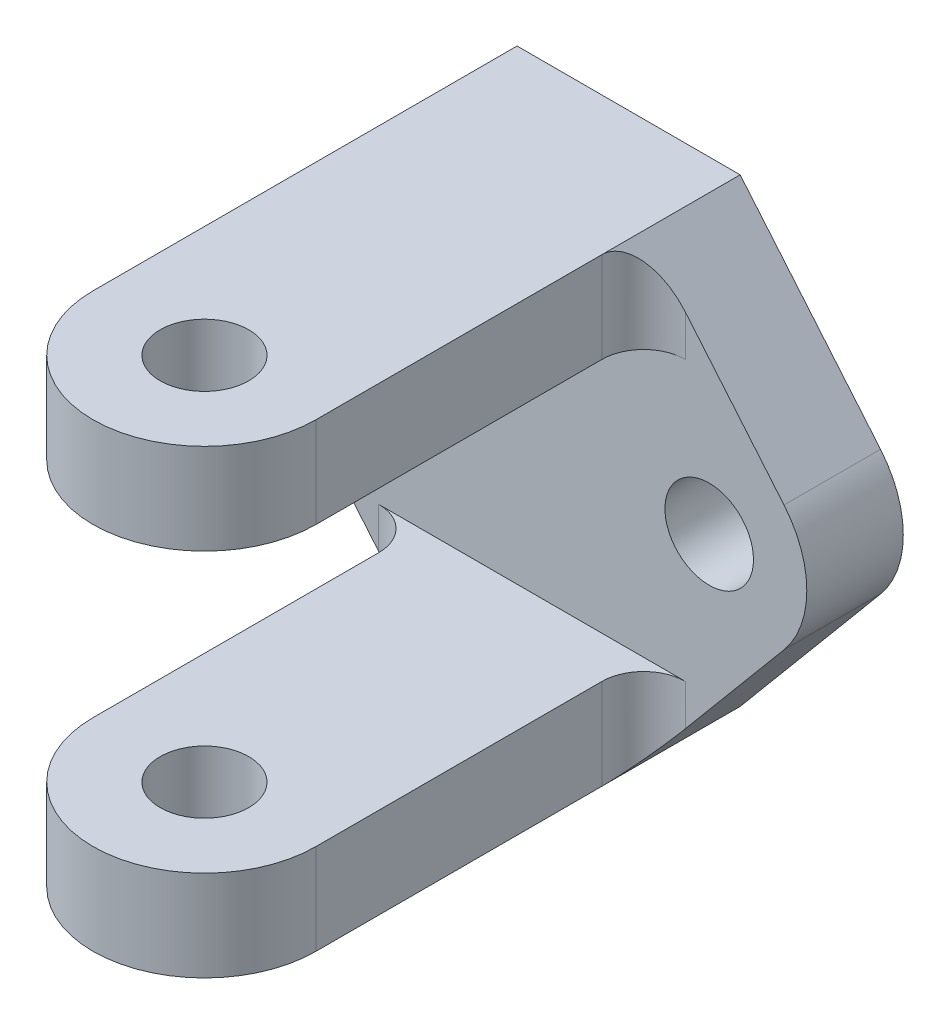
from build123d import *

# Parameters (mm, degrees)
SKETCH1_W                      = 41.4
SKETCH1_H                      = 33.02
SKETCH1_R                      = 3.175
BOSS_EXTRUDE1_DEPTH            = 12
SKETCH2_W                      = 41.4
SKETCH2_H                      = 6.51
BOSS_EXTRUDE2_DEPTH            = 53
CUT_EXTRUDE1_REACH             = 72.186
SKETCH4_R                      = 3.175
CUT_EXTRUDE1_DIRECTION_2_REACH = 72.186
CUT_EXTRUDE3_REACH             = 72.186
CUT_EXTRUDE3_DIRECTION_2_REACH = 72.186
CUT_EXTRUDE4_DEPTH             = 12
BOSS_EXTRUDE3_DEPTH            = 12
FILLET3_R                      = 3
CUT_EXTRUDE5_DEPTH             = 5.08


with BuildPart() as part:
    # Sketch1 → Boss-Extrude1 (new body)
    with BuildSketch(Plane.XY):
        Rectangle(SKETCH1_W, SKETCH1_H)
        with Locations((12.7, 0)):
            Circle(SKETCH1_R, mode=Mode.SUBTRACT)
        with Locations((-12.7, 0)):
            Circle(SKETCH1_R, mode=Mode.SUBTRACT)
    extrude(amount=BOSS_EXTRUDE1_DEPTH)

    # Sketch2 → Boss-Extrude2 (add)
    with BuildSketch(Plane.XY.offset(12)):
        with Locations((0, 13.255)):
            Rectangle(SKETCH2_W, SKETCH2_H)
        with Locations((0, -13.255)):
            Rectangle(SKETCH2_W, SKETCH2_H)
    extrude(amount=BOSS_EXTRUDE2_DEPTH)

    # Cut-Extrude1: up to this face of the body (flat: up to its plane)
    cut_extrude1_end = Plane(part.part.faces().sort_by_distance((0, -16.51, 32.5))[0])
    # Sketch4 → Cut-Extrude1 (cut, up to the picked face)
    with BuildSketch(Plane(origin=(0, 0, 0), x_dir=(1, 0, 0), z_dir=(0, 1, 0)), mode=Mode.PRIVATE) as cut_extrude1_sk1:
        with Locations(Location((0, -35.5, 0), (0, 0, 270))):
            Circle(SKETCH4_R)
    cut_extrude1_tool1 = split(extrude(cut_extrude1_sk1.sketch, amount=-CUT_EXTRUDE1_REACH, mode=Mode.PRIVATE), bisect_by=cut_extrude1_end, keep=Keep.BOTH, mode=Mode.PRIVATE)
    add(cut_extrude1_tool1.solids().sort_by(Axis((0, 0, 35.5), (0, -1, 0)))[0], mode=Mode.SUBTRACT)

    # Cut-Extrude1 direction 2: up to this face of the body (flat: up to its plane)
    cut_extrude1_direction_2_end = Plane(part.part.faces().sort_by_distance((0, 16.51, 32.5))[0])
    # Sketch4 → Cut-Extrude1 direction 2 (cut, up to the picked face)
    with BuildSketch(Plane(origin=(0, 0, 0), x_dir=(1, 0, 0), z_dir=(0, 1, 0)), mode=Mode.PRIVATE) as cut_extrude1_direction_2_sk1:
        with Locations(Location((0, -35.5, 0), (0, 0, 270))):
            Circle(SKETCH4_R)
    cut_extrude1_direction_2_tool1 = split(extrude(cut_extrude1_direction_2_sk1.sketch, amount=CUT_EXTRUDE1_DIRECTION_2_REACH, mode=Mode.PRIVATE), bisect_by=cut_extrude1_direction_2_end, keep=Keep.BOTH, mode=Mode.PRIVATE)
    add(cut_extrude1_direction_2_tool1.solids().sort_by(Axis((0, 0, 35.5), (0, 1, 0)))[0], mode=Mode.SUBTRACT)

    # Cut-Extrude3: up to this face of the body (flat: up to its plane)
    cut_extrude3_end = Plane(part.part.faces().sort_by_distance((-19.929353518, -16.51, 32.5))[0])
    # Sketch6 → Cut-Extrude3 (cut, up to the picked face)
    with BuildSketch(Plane(origin=(0, 0, 0), x_dir=(1, 0, 0), z_dir=(0, 1, 0)), mode=Mode.PRIVATE) as cut_extrude3_sk1:
        with BuildLine():
            Line((-8, -35.5), (-8, -20))
            Line((-8, -20), (-8, -12))
            Line((-8, -12), (-16, -12))
            Line((-16, -12), (-20.7, -12))
            Line((-20.7, -12), (-20.7, -65))
            Line((-20.7, -65), (20.7, -65))
            Line((20.7, -65), (20.7, -12))
            Line((20.7, -12), (16, -12))
            Line((16, -12), (8, -12))
            Line((8, -12), (8, -20))
            Line((8, -20), (8, -35.5))
            ThreePointArc((8, -35.5), (0, -43.5), (-8, -35.5))
        make_face()
    cut_extrude3_tool1 = split(extrude(cut_extrude3_sk1.sketch, amount=-CUT_EXTRUDE3_REACH, mode=Mode.PRIVATE), bisect_by=cut_extrude3_end, keep=Keep.BOTH, mode=Mode.PRIVATE)
    add(cut_extrude3_tool1.solids().sort_by(Axis((-8.67253, 0, 27.75), (0, -1, 0)))[0], mode=Mode.SUBTRACT)

    # Cut-Extrude3 direction 2: up to this face of the body (flat: up to its plane)
    cut_extrude3_direction_2_end = Plane(part.part.faces().sort_by_distance((19.929353518, 16.51, 32.5))[0])
    # Sketch6 → Cut-Extrude3 direction 2 (cut, up to the picked face)
    with BuildSketch(Plane(origin=(0, 0, 0), x_dir=(1, 0, 0), z_dir=(0, 1, 0)), mode=Mode.PRIVATE) as cut_extrude3_direction_2_sk1:
        with BuildLine():
            Line((-8, -35.5), (-8, -20))
            Line((-8, -20), (-8, -12))
            Line((-8, -12), (-16, -12))
            Line((-16, -12), (-20.7, -12))
            Line((-20.7, -12), (-20.7, -65))
            Line((-20.7, -65), (20.7, -65))
            Line((20.7, -65), (20.7, -12))
            Line((20.7, -12), (16, -12))
            Line((16, -12), (8, -12))
            Line((8, -12), (8, -20))
            Line((8, -20), (8, -35.5))
            ThreePointArc((8, -35.5), (0, -43.5), (-8, -35.5))
        make_face()
    cut_extrude3_direction_2_tool1 = split(extrude(cut_extrude3_direction_2_sk1.sketch, amount=CUT_EXTRUDE3_DIRECTION_2_REACH, mode=Mode.PRIVATE), bisect_by=cut_extrude3_direction_2_end, keep=Keep.BOTH, mode=Mode.PRIVATE)
    add(cut_extrude3_direction_2_tool1.solids().sort_by(Axis((-8.67253, 0, 27.75), (0, 1, 0)))[0], mode=Mode.SUBTRACT)

    # Sketch7 → Cut-Extrude4 (cut)
    with BuildSketch(Plane.XY):
        with BuildLine():
            ThreePointArc((-12.7, 7), (-19.7, 0), (-12.7, -7))
            Line((-12.7, -7), (-8, -7))
            Line((-8, -7), (-8, -16.51))
            Line((-8, -16.51), (-20.7, -16.51))
            Line((-20.7, -16.51), (-20.7, 16.51))
            Line((-20.7, 16.51), (-8, 16.51))
            Line((-8, 16.51), (-8, 7))
            Line((-8, 7), (-12.7, 7))
        make_face()
        with BuildLine():
            Line((12.7, 7), (8, 7))
            Line((8, 7), (8, 16.51))
            Line((8, 16.51), (20.7, 16.51))
            Line((20.7, 16.51), (20.7, -16.51))
            Line((20.7, -16.51), (8, -16.51))
            Line((8, -16.51), (8, -7))
            Line((8, -7), (12.7, -7))
            ThreePointArc((12.7, -7), (19.7, 0), (12.7, 7))
        make_face()
    extrude(amount=CUT_EXTRUDE4_DEPTH, mode=Mode.SUBTRACT)

    # Sketch8 → Boss-Extrude3 (add)
    with BuildSketch(Plane.XY):
        with BuildLine():
            Line((8, -16.51), (18.065759147, -4.495400847))
            ThreePointArc((18.065759147, -4.495400847), (15.660759537, -6.343020019), (12.7, -7))
            Line((12.7, -7), (8, -7))
            Line((8, -7), (8, -16.51))
        make_face()
        with BuildLine():
            ThreePointArc((-18.065759147, -4.495400847), (-15.660759537, -6.343020019), (-12.7, -7))
            Line((-12.7, -7), (-8, -7))
            Line((-8, -7), (-8, -16.51))
            Line((-8, -16.51), (-18.065759147, -4.495400847))
        make_face()
        with BuildLine():
            Line((8, 16.51), (18.065759147, 4.495400847))
            ThreePointArc((18.065759147, 4.495400847), (15.660759537, 6.343020019), (12.7, 7))
            Line((12.7, 7), (8, 7))
            Line((8, 7), (8, 16.51))
        make_face()
        with BuildLine():
            Line((-8, 16.51), (-18.065759147, 4.495400847))
            ThreePointArc((-18.065759147, 4.495400847), (-15.660759537, 6.343020019), (-12.7, 7))
            Line((-12.7, 7), (-8, 7))
            Line((-8, 7), (-8, 16.51))
        make_face()
    extrude(amount=BOSS_EXTRUDE3_DEPTH)

    # Fillet3
    fillet3_edges = [part.edges().sort_by_distance(p)[0] for p in [
        (8, -13.255, 12),
        (-8, -13.255, 12),
        (8, 13.255, 12),
        (-8, 13.255, 12),
    ]]
    fillet(fillet3_edges, radius=FILLET3_R)

    # Sketch10 → Cut-Extrude5 (cut)
    with BuildSketch(Plane.XY):
        with BuildLine():
            Line((-8, 16.51), (-18.065759147, 4.495400847))
            ThreePointArc((-18.065759147, 4.495400847), (-19.7, 0), (-18.065759147, -4.495400847))
            Line((-18.065759147, -4.495400847), (-8, -16.51))
            Line((-8, -16.51), (8, -16.51))
            Line((8, -16.51), (18.065759147, -4.495400847))
            ThreePointArc((18.065759147, -4.495400847), (19.7, 0), (18.065759147, 4.495400847))
            Line((18.065759147, 4.495400847), (8, 16.51))
            Line((8, 16.51), (-8, 16.51))
        make_face()
    extrude(amount=CUT_EXTRUDE5_DEPTH, mode=Mode.SUBTRACT)


solid = part.part
